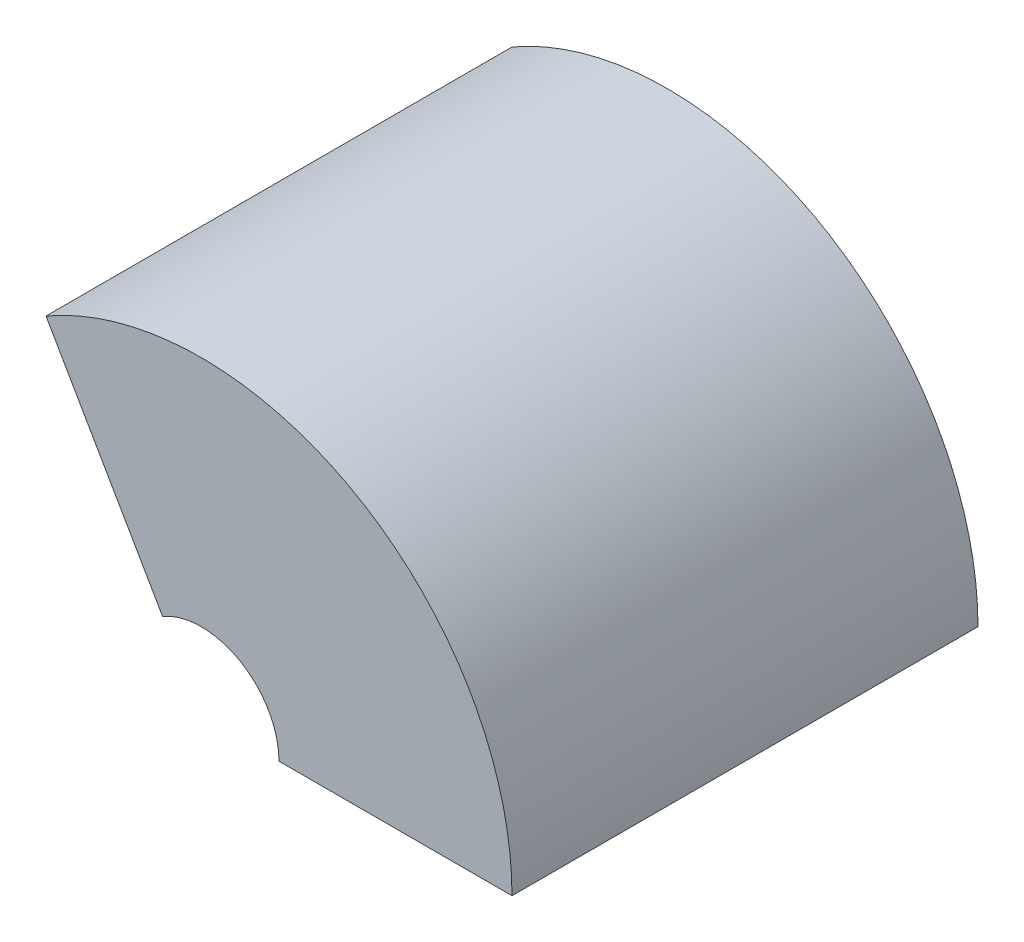
from build123d import *

# Parameters (mm, degrees)
SKETCH1_W      = 15
SKETCH1_H      = 30
REVOLVE1_ANGLE = 120


with BuildPart() as part:
    # Sketch1 → Revolve1 (revolve)
    with BuildSketch(Plane(origin=(0, 0, 0), x_dir=(1, 0, 0), z_dir=(0, 1, 0))):
        with Locations((12.5, 15)):
            Rectangle(SKETCH1_W, SKETCH1_H)
    revolve(axis=Axis((0, 0, 0), (0, 0, 1)), revolution_arc=REVOLVE1_ANGLE)


solid = part.part
